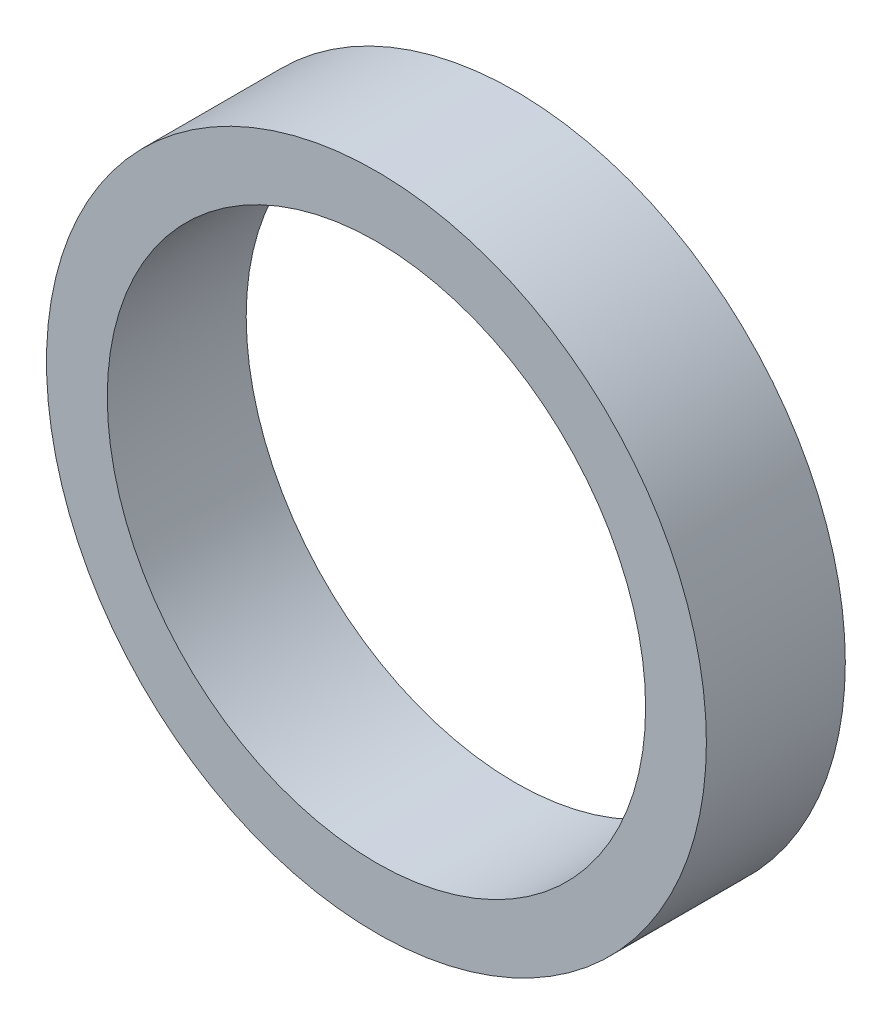
from build123d import *

# Parameters (mm, degrees)
SKETCH1_R           = 19
SKETCH1_R_2         = 15.5
BOSS_EXTRUDE1_DEPTH = 8


with BuildPart() as part:
    # Sketch1 → Boss-Extrude1 (new body)
    with BuildSketch(Plane.XY):
        Circle(SKETCH1_R)
        Circle(SKETCH1_R_2, mode=Mode.SUBTRACT)
    extrude(amount=BOSS_EXTRUDE1_DEPTH)


solid = part.part
